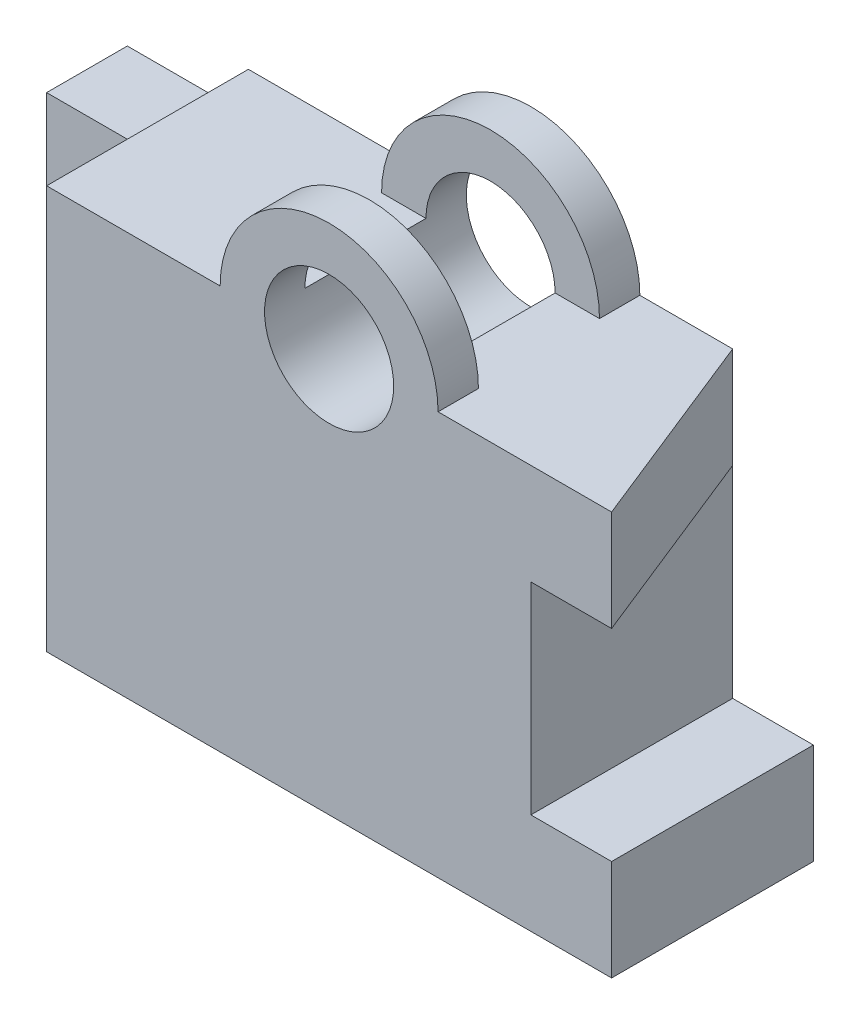
from build123d import *

# Parameters (mm, degrees)
EXTRUDE_1_DEPTH     = 25
EXTRUDE_START       = -5
SKETCH_3_R          = 13.5
SKETCH_3_R_2        = 8
EXTRUDE_2_DEPTH     = 5
CUT_EXTRUDE_1_DEPTH = 58.063561053
SKETCH_5_W          = 10
SKETCH_5_H          = 14
EXTRUDE_3_DEPTH     = 11
SKETCH_6_W          = 15
SKETCH_6_H          = 13
EXTRUDE_4_DEPTH     = 10
SKETCH_7_W          = 10
SKETCH_7_H          = 14
CUT_EXTRUDE_2_DEPTH = 11
SKETCH_8_W          = 15
SKETCH_8_H          = 13
EXTRUDE_5_DEPTH     = 10
SKETCH_9_W          = 15
SKETCH_9_H          = 10
CUT_EXTRUDE_3_DEPTH = 3
EXTRUDE_6_DEPTH     = 25


with BuildPart() as part:
    # Эскиз1 → Бобышка-Вытянуть1 (new body)
    with BuildSketch(Plane.XY):
        with BuildLine():
            Line((-35, 25), (-35, -25))
            Line((-35, -25), (35, -25))
            Line((35, -25), (35, -12.5))
            Line((35, -12.5), (25, -12.5))
            Line((25, -12.5), (25, 12.5))
            Line((25, 12.5), (35, 12.5))
            Line((35, 12.5), (35, 25))
            Line((35, 25), (8, 25))
            ThreePointArc((8, 25), (0, 17), (-8, 25))
            Line((-8, 25), (-35, 25))
        make_face()
        Polygon((4, -19), (-4, -19), (-4, -4), (-4, 4), (0, 4), (0, -4), (4, -4), align=None, mode=Mode.SUBTRACT)
    extrude(amount=EXTRUDE_1_DEPTH)

    # Эскиз3 → Бобышка-Вытянуть2 (add)
    with BuildSketch(Plane.XY.offset(25).offset(EXTRUDE_START)):
        with Locations((0, 25)):
            Circle(SKETCH_3_R)
        with Locations((0, 25)):
            Circle(SKETCH_3_R_2, mode=Mode.SUBTRACT)
    extrude_2 = extrude(amount=EXTRUDE_2_DEPTH)

    # Эскиз4 → Вырез-Вытянуть1 (cut, through all)
    with BuildSketch(Plane.XZ.offset(-12.5)):
        Polygon((35, 25), (25, 0), (35, 0), align=None)
    extrude(amount=-CUT_EXTRUDE_1_DEPTH, mode=Mode.SUBTRACT)

    # Эскиз5 → Бобышка-Вытянуть3 (add)
    with BuildSketch(Plane.XY.offset(25)):
        with Locations((-30, 0)):
            Rectangle(SKETCH_5_W, SKETCH_5_H)
    extrude(amount=EXTRUDE_3_DEPTH)

    # Эскиз6 → Бобышка-Вытянуть4 (add)
    with BuildSketch(Plane(origin=(0, 0, 0), x_dir=(-1, 0, 0), z_dir=(0, 0, -1))):
        with Locations((42.5, 13.5)):
            Rectangle(SKETCH_6_W, SKETCH_6_H)
    extrude(amount=-EXTRUDE_4_DEPTH)

    # Эскиз7 → Вырез-Вытянуть2 (cut)
    with BuildSketch(Plane.XY.offset(36)):
        with Locations((-30, 0)):
            Rectangle(SKETCH_7_W, SKETCH_7_H)
    extrude(amount=-CUT_EXTRUDE_2_DEPTH, mode=Mode.SUBTRACT)

    # Эскиз8 → Бобышка-Вытянуть5 (add)
    with BuildSketch(Plane(origin=(0, 0, 0), x_dir=(-1, 0, 0), z_dir=(0, 0, -1))):
        with Locations((27.5, 0.5)):
            Rectangle(SKETCH_8_W, SKETCH_8_H)
    extrude(amount=EXTRUDE_5_DEPTH)

    # Эскиз9 → Вырез-Вытянуть3 (cut)
    with BuildSketch(Plane(origin=(0, 7, 0), x_dir=(1, 0, 0), z_dir=(0, 1, 0))):
        with Locations((-27.5, 5)):
            Rectangle(SKETCH_9_W, SKETCH_9_H)
    extrude(amount=-CUT_EXTRUDE_3_DEPTH, mode=Mode.SUBTRACT)

    # Эскиз10 → Бобышка-Вытянуть6 (add)
    with BuildSketch(Plane(origin=(0, 0, 0), x_dir=(-1, 0, 0), z_dir=(0, 0, -1))):
        Polygon((4, -19), (4, 4), (0, 4), (0, -4), (-4, -4), (-4, -19), align=None)
    extrude(amount=-EXTRUDE_6_DEPTH)

    # Зеркальное отражение1: Бобышка-Вытянуть2 across plane
    add(extrude_2.mirror(Plane(origin=(0, 0, 12.5), x_dir=(1, 0, 0), z_dir=(0, 0, -1))))


solid = part.part
